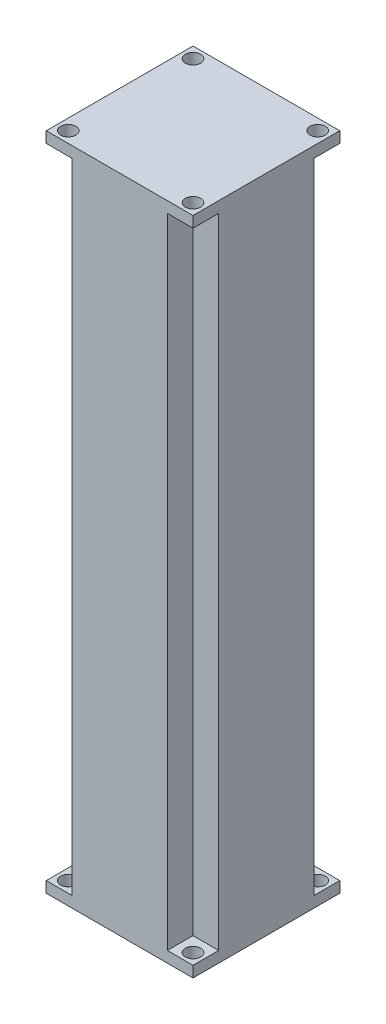
from build123d import *

# Parameters (mm, degrees)
SKETCH1_W                                  = 50.8
SKETCH1_H                                  = 50.8
BOSS_EXTRUDE1_DEPTH                        = 228.6
SKETCH2_W                                  = 8.89
SKETCH2_H                                  = 220.98
CUT_EXTRUDE1_DEPTH                         = 8.89
F_4_0_209_DIAMETER_HOLE1_D                 = 5.3086
F_4_0_209_DIAMETER_HOLE1_DEPTH             = 3.81
F_4_0_209_DIAMETER_HOLE2_D                 = 5.3086
MIRROR1_AT_THE_SECOND_PLANE_COPY_1_SKETC_W = 8.89
MIRROR1_AT_THE_SECOND_PLANE_COPY_1_SKETC_H = 220.98
MIRROR1_AT_THE_SECOND_PLANE_COPY_1_DEPTH   = 8.89
MIRROR1_AT_THE_SECOND_PLANE_COPY_2_D       = 5.3086
MIRROR1_AT_THE_SECOND_PLANE_COPY_2_DEPTH   = 3.81
MIRROR1_AT_THE_SECOND_PLANE_COPY_3_D       = 5.3086


with BuildPart() as part:
    # Sketch1 → Boss-Extrude1 (new body)
    with BuildSketch(Plane(origin=(0, 0, 0), x_dir=(1, 0, 0), z_dir=(0, 1, 0))):
        Rectangle(SKETCH1_W, SKETCH1_H)
    extrude(amount=BOSS_EXTRUDE1_DEPTH)

    # Sketch2 → Cut-Extrude1 (cut)
    with BuildSketch(Plane.XY.offset(25.4)):
        with Locations((20.955, 114.3)):
            Rectangle(SKETCH2_W, SKETCH2_H)
    cut_extrude1 = extrude(amount=-CUT_EXTRUDE1_DEPTH, mode=Mode.SUBTRACT)

    # #4 (0.209) Diameter Hole1
    with Locations(Plane(origin=(0, 3.81, 0), x_dir=(1, 0, 0), z_dir=(0, 1, 0))):
        with Locations((21.59, -21.59)):
            f_4_0_209_diameter_hole1 = Hole(F_4_0_209_DIAMETER_HOLE1_D / 2, depth=F_4_0_209_DIAMETER_HOLE1_DEPTH)

    # #4 (0.209) Diameter Hole2 (through all)
    with Locations(Plane(origin=(0, 224.79, 0), x_dir=(-1, 0, 0), z_dir=(0, -1, 0))):
        with Locations((-21.59, -21.59)):
            f_4_0_209_diameter_hole2 = Hole(F_4_0_209_DIAMETER_HOLE2_D / 2)

    # Mirror1: Cut-Extrude1, #4 (0.209) Diameter Hole1, #4 (0.209) Diameter Hole2 across plane
    add(cut_extrude1.mirror(Plane(origin=(0, 0, 0), x_dir=(0, 0, 1), z_dir=(1, 0, 0))), mode=Mode.SUBTRACT)
    add(f_4_0_209_diameter_hole1.mirror(Plane(origin=(0, 0, 0), x_dir=(0, 0, 1), z_dir=(1, 0, 0))), mode=Mode.SUBTRACT)
    add(f_4_0_209_diameter_hole2.mirror(Plane(origin=(0, 0, 0), x_dir=(0, 0, 1), z_dir=(1, 0, 0))), mode=Mode.SUBTRACT)

    # Mirror1 at the second plane: Cut-Extrude1, #4 (0.209) Diameter Hole1, #4 (0.209) Diameter Hole2 across plane
    add(cut_extrude1.mirror(Plane.XY), mode=Mode.SUBTRACT)
    add(f_4_0_209_diameter_hole1.mirror(Plane.XY), mode=Mode.SUBTRACT)
    add(f_4_0_209_diameter_hole2.mirror(Plane.XY), mode=Mode.SUBTRACT)

    # Mirror1 at the second plane copy 1 sketc → Mirror1 at the second plane copy 1 (cut)
    with BuildSketch(Plane(origin=(0, 0, -25.4), x_dir=(-1, 0, 0), z_dir=(0, 0, -1))):
        with Locations((20.955, 114.3)):
            Rectangle(MIRROR1_AT_THE_SECOND_PLANE_COPY_1_SKETC_W, MIRROR1_AT_THE_SECOND_PLANE_COPY_1_SKETC_H)
    extrude(amount=-MIRROR1_AT_THE_SECOND_PLANE_COPY_1_DEPTH, mode=Mode.SUBTRACT)

    # Mirror1 at the second plane copy 2
    with Locations(Plane(origin=(0, 3.81, 0), x_dir=(-1, 0, 0), z_dir=(0, 1, 0))):
        with Locations((21.59, -21.59)):
            Hole(MIRROR1_AT_THE_SECOND_PLANE_COPY_2_D / 2, depth=MIRROR1_AT_THE_SECOND_PLANE_COPY_2_DEPTH)

    # Mirror1 at the second plane copy 3 (through all)
    with Locations(Plane.XZ.offset(-224.79)):
        with Locations((-21.59, -21.59)):
            Hole(MIRROR1_AT_THE_SECOND_PLANE_COPY_3_D / 2)


solid = part.part
